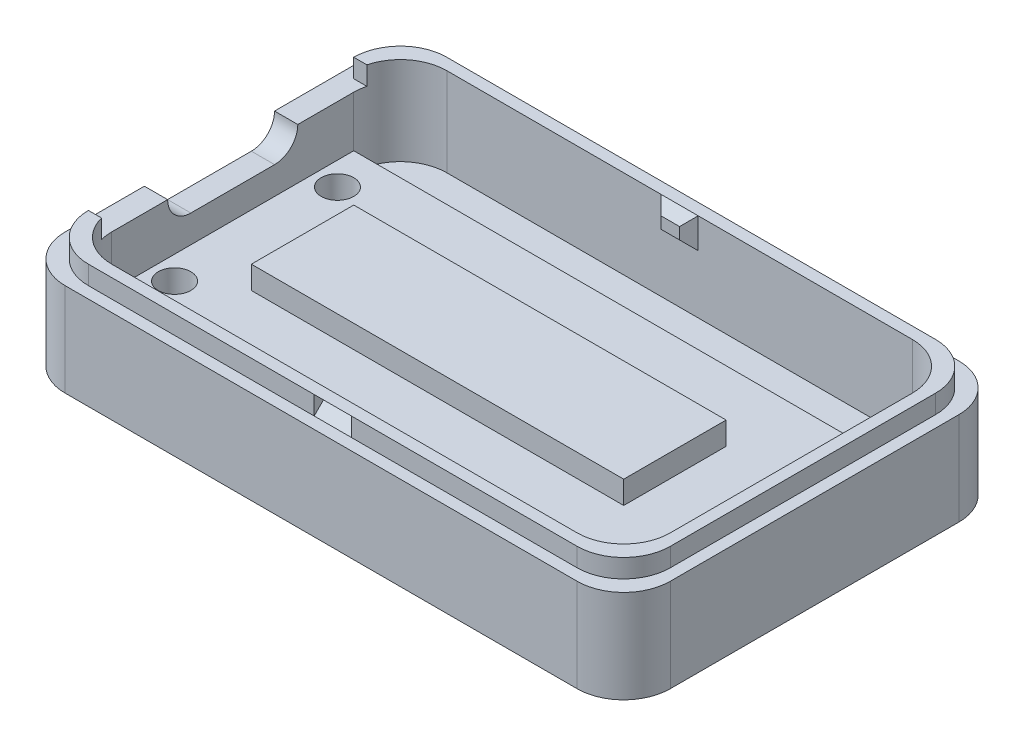
from build123d import *

# Parameters (mm, degrees)
SKETCH2_W                 = 55
SKETCH2_H                 = 26
BOSS_EXTRUDE3_DEPTH       = 4.55
SKETCH4_W                 = 40
SKETCH4_H                 = 11
BOSS_EXTRUDE5_DEPTH       = 7
BOSS_EXTRUDE6_DEPTH       = 2.5
BOSS_EXTRUDE7_DEPTH       = 10
BOSS_EXTRUDE9_DEPTH       = 2
BOSS_EXTRUDE10_DEPTH      = 2
BOSS_EXTRUDE10_DEPTH_BACK = 2
CUT_EXTRUDE2_DEPTH        = 2
CUT_EXTRUDE2_DEPTH_BACK   = 2
CUT_EXTRUDE3_DEPTH        = 4
CUT_EXTRUDE4_DEPTH        = 5
CUT_EXTRUDE4_DEPTH_BACK   = 5
CUT_EXTRUDE6_DEPTH        = 10
SKETCH14_R                = 1.75
CUT_EXTRUDE7_DEPTH        = 4


with BuildPart() as part:
    # Sketch2 → Boss-Extrude3 (new body)
    with BuildSketch(Plane(origin=(0, 0, 0), x_dir=(1, 0, 0), z_dir=(0, 1, 0))):
        with Locations((27.5, 13)):
            Rectangle(SKETCH2_W, SKETCH2_H)
    extrude(amount=BOSS_EXTRUDE3_DEPTH)

    # Sketch4 → Boss-Extrude5 (add)
    with BuildSketch(Plane(origin=(0, 0, 0), x_dir=(1, 0, 0), z_dir=(0, 1, 0))):
        with Locations((27.5, 13)):
            Rectangle(SKETCH4_W, SKETCH4_H)
    extrude(amount=BOSS_EXTRUDE5_DEPTH)

    # Sketch5 → Boss-Extrude6 (add)
    with BuildSketch(Plane(origin=(0, 0, 0), x_dir=(1, 0, 0), z_dir=(0, 1, 0))):
        with BuildLine():
            Line((5, 31), (55, 31))
            ThreePointArc((55, 31), (58.535533906, 29.535533906), (60, 26))
            Line((60, 26), (60, 0))
            ThreePointArc((60, 0), (58.535533906, -3.535533906), (55, -5))
            Line((55, -5), (5, -5))
            ThreePointArc((5, -5), (1.464466094, -3.535533906), (0, 0))
            Line((0, 0), (0, 26))
            ThreePointArc((0, 26), (1.464466094, 29.535533906), (5, 31))
        make_face()
    extrude(amount=BOSS_EXTRUDE6_DEPTH)

    # Sketch6 → Boss-Extrude7 (add)
    with BuildSketch(Plane(origin=(0, 0, 0), x_dir=(1, 0, 0), z_dir=(0, 1, 0))):
        with BuildLine():
            Line((2.5, 33.5), (57.5, 33.5))
            ThreePointArc((57.5, 33.5), (61.035533906, 32.035533906), (62.5, 28.5))
            Line((62.5, 28.5), (62.5, -2.5))
            ThreePointArc((62.5, -2.5), (61.035533906, -6.035533906), (57.5, -7.5))
            Line((57.5, -7.5), (2.5, -7.5))
            ThreePointArc((2.5, -7.5), (-1.035533906, -6.035533906), (-2.5, -2.5))
            Line((-2.5, -2.5), (-2.5, 28.5))
            ThreePointArc((-2.5, 28.5), (-1.035533906, 32.035533906), (2.5, 33.5))
        make_face()
        with BuildLine():
            Line((5, 31), (55, 31))
            ThreePointArc((55, 31), (58.535533906, 29.535533906), (60, 26))
            Line((60, 26), (60, 0))
            ThreePointArc((60, 0), (58.535533906, -3.535533906), (55, -5))
            Line((55, -5), (5, -5))
            ThreePointArc((5, -5), (1.464466094, -3.535533906), (0, 0))
            Line((0, 0), (0, 26))
            ThreePointArc((0, 26), (1.464466094, 29.535533906), (5, 31))
        make_face(mode=Mode.SUBTRACT)
    extrude(amount=BOSS_EXTRUDE7_DEPTH)

    # Sketch8 → Boss-Extrude9 (add)
    with BuildSketch(Plane(origin=(0, 10, 0), x_dir=(1, 0, 0), z_dir=(0, 1, 0))):
        with BuildLine():
            Line((56.25, 32.25), (3.75, 32.25))
            ThreePointArc((3.75, 32.25), (0.214466094, 30.785533906), (-1.25, 27.25))
            Line((-1.25, 27.25), (0.158770817, 27.25))
            ThreePointArc((0.158770817, 27.25), (1.938137822, 29.952847075), (5, 31))
            Line((5, 31), (55, 31))
            ThreePointArc((55, 31), (58.535533906, 29.535533906), (60, 26))
            Line((60, 26), (60, 0))
            ThreePointArc((60, 0), (58.535533906, -3.535533906), (55, -5))
            Line((55, -5), (5, -5))
            ThreePointArc((5, -5), (1.938137822, -3.952847075), (0.158770817, -1.25))
            Line((0.158770817, -1.25), (-1.25, -1.25))
            ThreePointArc((-1.25, -1.25), (0.214466094, -4.785533906), (3.75, -6.25))
            Line((3.75, -6.25), (56.25, -6.25))
            ThreePointArc((56.25, -6.25), (59.785533906, -4.785533906), (61.25, -1.25))
            Line((61.25, -1.25), (61.25, 27.25))
            ThreePointArc((61.25, 27.25), (59.785533906, 30.785533906), (56.25, 32.25))
        make_face()
    extrude(amount=BOSS_EXTRUDE9_DEPTH)

    # Sketch9 → Boss-Extrude10 (add, two sides: drawn at the far end of the back side and taken through both)
    with BuildSketch(Plane(origin=(30, 0, 0), x_dir=(0, 0, -1), z_dir=(1, 0, 0)).offset(-BOSS_EXTRUDE10_DEPTH_BACK)):
        Polygon((-5, 12), (-4, 11), (-4, 9.75), (-5, 8.75), align=None)
        Polygon((31, 12), (30, 11), (30, 9.75), (31, 8.75), align=None)
    extrude(amount=BOSS_EXTRUDE10_DEPTH + BOSS_EXTRUDE10_DEPTH_BACK)

    # Sketch10 → Cut-Extrude2 (cut, two sides: drawn at the far end of the back side and taken through both)
    with BuildSketch(Plane(origin=(30, 0, 0), x_dir=(0, 0, -1), z_dir=(1, 0, 0)).offset(-CUT_EXTRUDE2_DEPTH_BACK)):
        Polygon((-6.25, 12), (-5.249964226, 10.999964226), (-6.25, 10), align=None)
        Polygon((32.25, 12), (31.25, 11), (32.25, 10), align=None)
    extrude(amount=CUT_EXTRUDE2_DEPTH + CUT_EXTRUDE2_DEPTH_BACK, mode=Mode.SUBTRACT)

    # Sketch11 → Cut-Extrude3 (cut)
    with BuildSketch(Plane(origin=(0, 12, 0), x_dir=(1, 0, 0), z_dir=(0, 1, 0))):
        Polygon((32, 31), (32, 30), (31, 30), align=None)
        Polygon((28, 31), (28, 30), (29, 30), align=None)
        Polygon((28, -5), (28, -4), (29, -4), align=None)
        Polygon((32, -5), (32, -4), (31, -4), align=None)
    extrude(amount=-CUT_EXTRUDE3_DEPTH, mode=Mode.SUBTRACT)

    # Sketch12 → Cut-Extrude4 (cut, two sides: drawn at the far end of the back side and taken through both)
    with BuildSketch(Plane(origin=(30, 0, 0), x_dir=(0, 0, -1), z_dir=(1, 0, 0)).offset(-CUT_EXTRUDE4_DEPTH_BACK)):
        Polygon((23.5, 0), (26, 0), (24.75, 1.25), align=None)
    extrude(amount=CUT_EXTRUDE4_DEPTH + CUT_EXTRUDE4_DEPTH_BACK, mode=Mode.SUBTRACT)

    # Sketch7 → Cut-Extrude6 (cut)
    with BuildSketch(Plane(origin=(0, 0, 0), x_dir=(0, 0, -1), z_dir=(1, 0, 0))):
        with BuildLine():
            Line((13, 10), (19.990431296, 10))
            ThreePointArc((19.990431296, 10), (19.261010337, 11.760977972), (17.500032365, 12.490398932))
            Line((17.500032365, 12.490398932), (8.499967635, 12.490398932))
            ThreePointArc((8.499967635, 12.490398932), (6.738989663, 11.760977972), (6.009568704, 10))
            Line((6.009568704, 10), (13, 10))
        make_face()
        with BuildLine():
            ThreePointArc((17.500032365, 7.509601068), (19.261010337, 8.239022028), (19.990431296, 10))
            Line((19.990431296, 10), (13, 10))
            Line((13, 10), (6.009568704, 10))
            ThreePointArc((6.009568704, 10), (6.738989663, 8.239022028), (8.499967635, 7.509601068))
            Line((8.499967635, 7.509601068), (17.500032365, 7.509601068))
        make_face()
    extrude(amount=-CUT_EXTRUDE6_DEPTH, mode=Mode.SUBTRACT)

    # Sketch14 → Cut-Extrude7 (cut)
    with BuildSketch(Plane(origin=(0, 5, 0), x_dir=(1, 0, 0), z_dir=(0, 1, 0))):
        with Locations(Location((2.5, 21.75, 0), (0, 0, 270))):
            Circle(SKETCH14_R)
        with Locations(Location((2.5, 4.25, 0), (0, 0, 270))):
            Circle(SKETCH14_R)
    extrude(amount=-CUT_EXTRUDE7_DEPTH, mode=Mode.SUBTRACT)


solid = part.part
